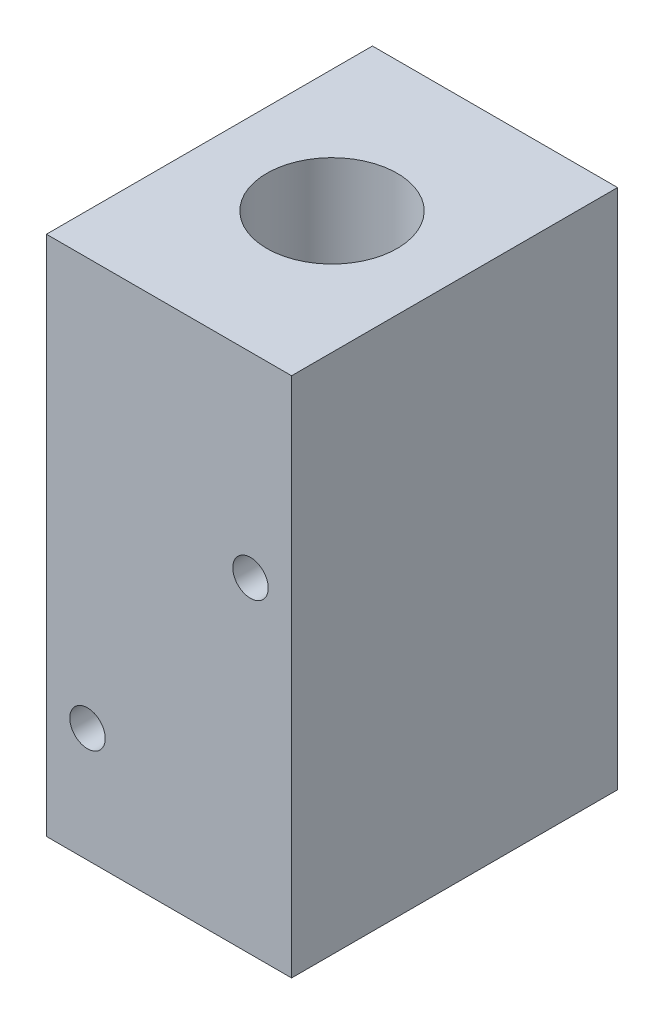
from build123d import *

# Parameters (mm, degrees)
BOSS_EXTRUDE1_DEPTH      = 11.938
BOSS_EXTRUDE1_DEPTH_BACK = 11.938
SKETCH1_W                = 31.75
SKETCH1_H                = 50.8
CUT_EXTRUDE2_DEPTH       = 62.083699495
CUT_EXTRUDE2_DEPTH_BACK  = 3.175
SKETCH3_R                = 1.7272
SKETCH4_R                = 6.35
CUT_EXTRUDE3_DEPTH       = 38.1


with BuildPart() as part:
    # Sketch1 → Boss-Extrude1 (new, two sides: drawn at the far end of the back side and taken through both)
    with BuildSketch(Plane(origin=(0, 0, 0), x_dir=(0, 0, -1), z_dir=(1, 0, 0)).offset(-BOSS_EXTRUDE1_DEPTH_BACK)):
        with Locations((0, -25.4)):
            Rectangle(SKETCH1_W, SKETCH1_H)
    extrude(amount=BOSS_EXTRUDE1_DEPTH + BOSS_EXTRUDE1_DEPTH_BACK)

    # Sketch3 → Cut-Extrude2 (cut, two sides: drawn at the far end of the back side and taken through both)
    with BuildSketch(Plane.XY.offset(15.875).offset(-CUT_EXTRUDE2_DEPTH_BACK)):
        with Locations(Location((7.9375, -19.05, 0), (0, 0, 180))):
            Circle(SKETCH3_R)
        with Locations(Location((-7.9375, -39.6748, 0), (0, 0, 180))):
            Circle(SKETCH3_R)
    extrude(amount=CUT_EXTRUDE2_DEPTH + CUT_EXTRUDE2_DEPTH_BACK, mode=Mode.SUBTRACT)

    # Sketch4 → Cut-Extrude3 (cut)
    with BuildSketch(Plane(origin=(0, 0, 0), x_dir=(1, 0, 0), z_dir=(0, 1, 0))):
        with Locations(Location((0, 0, 0), (0, 0, 270))):
            Circle(SKETCH4_R)
    extrude(amount=-CUT_EXTRUDE3_DEPTH, mode=Mode.SUBTRACT)


solid = part.part
